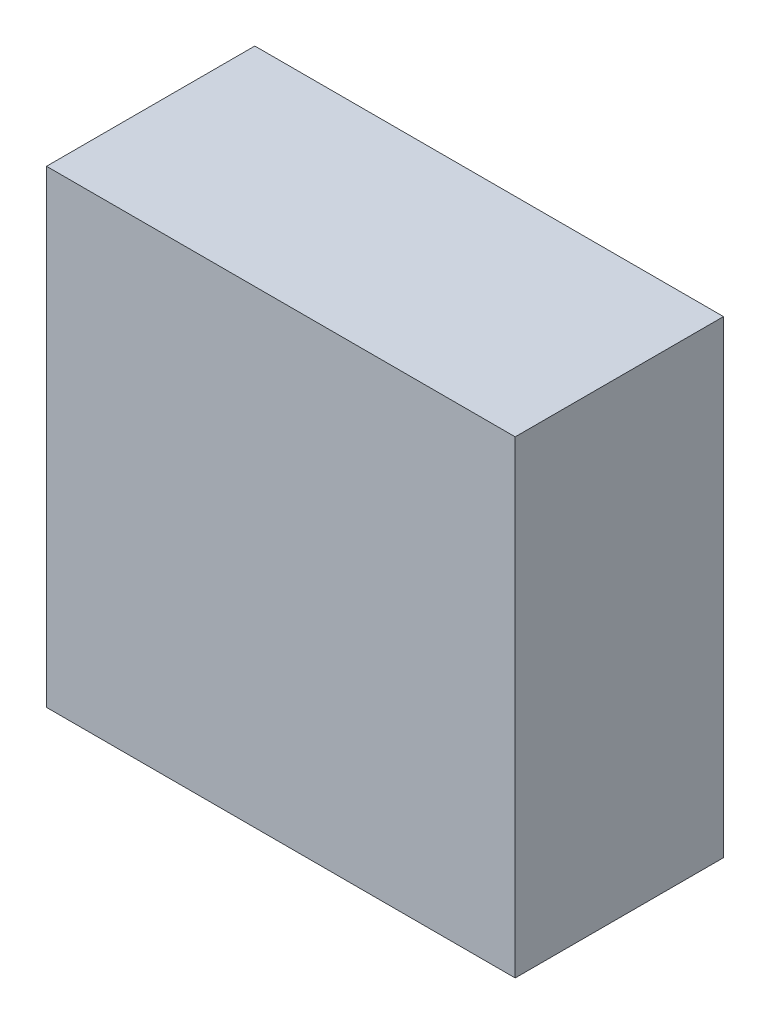
from build123d import *

# Parameters (mm, degrees)
SKETCH_1_W      = 72
SKETCH_1_H      = 72
EXTRUDE_1_DEPTH = 32


with BuildPart() as part:
    # 草图1 → 凸台-拉伸1 (new body)
    with BuildSketch(Plane.XY):
        Rectangle(SKETCH_1_W, SKETCH_1_H)
    extrude(amount=EXTRUDE_1_DEPTH)


solid = part.part
